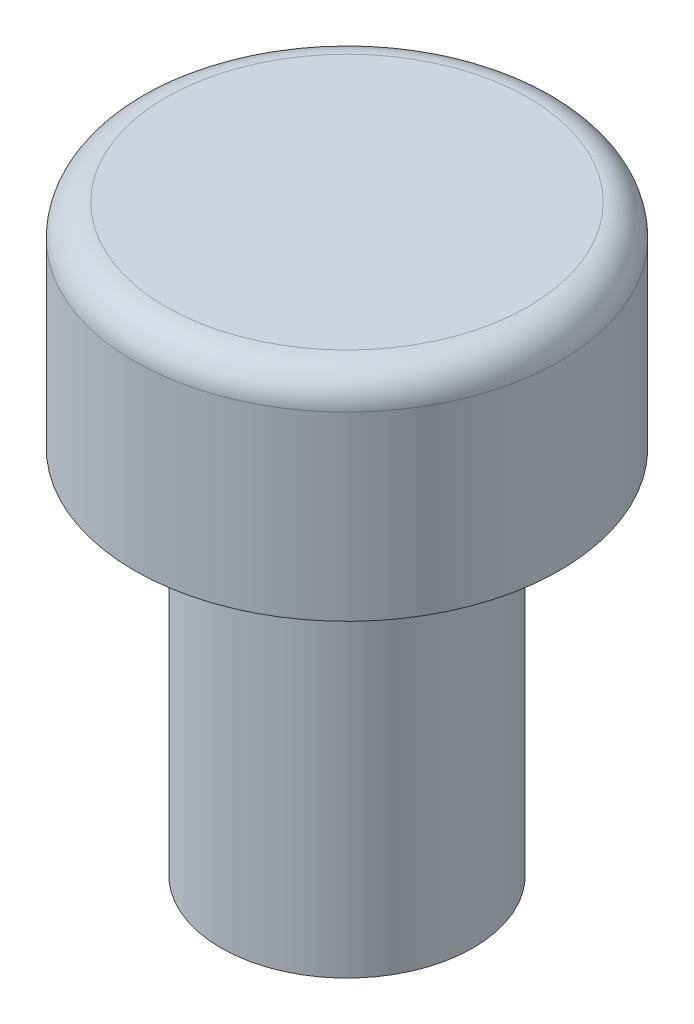
from build123d import *

# Parameters (mm, degrees)
FILLET1_R = 2


with BuildPart() as part:
    # Sketch1 → Revolve1 (revolve)
    with BuildSketch(Plane.XY, mode=Mode.PRIVATE) as revolve1_sk:
        Polygon((0, 0), (0, 37), (13.5, 37), (13.5, 23.5), (8, 23.5), (8, 0), align=None)
    revolve(revolve1_sk.sketch.rotate(Axis((0, 0, 0), (0, 1, 0)), 90), axis=Axis((0, 0, 0), (0, 1, 0)))

    # Fillet1
    fillet1_edges = [part.edges().sort_by_distance(p)[0] for p in [
        (0, 37, 13.5),
    ]]
    fillet(fillet1_edges, radius=FILLET1_R)


solid = part.part
